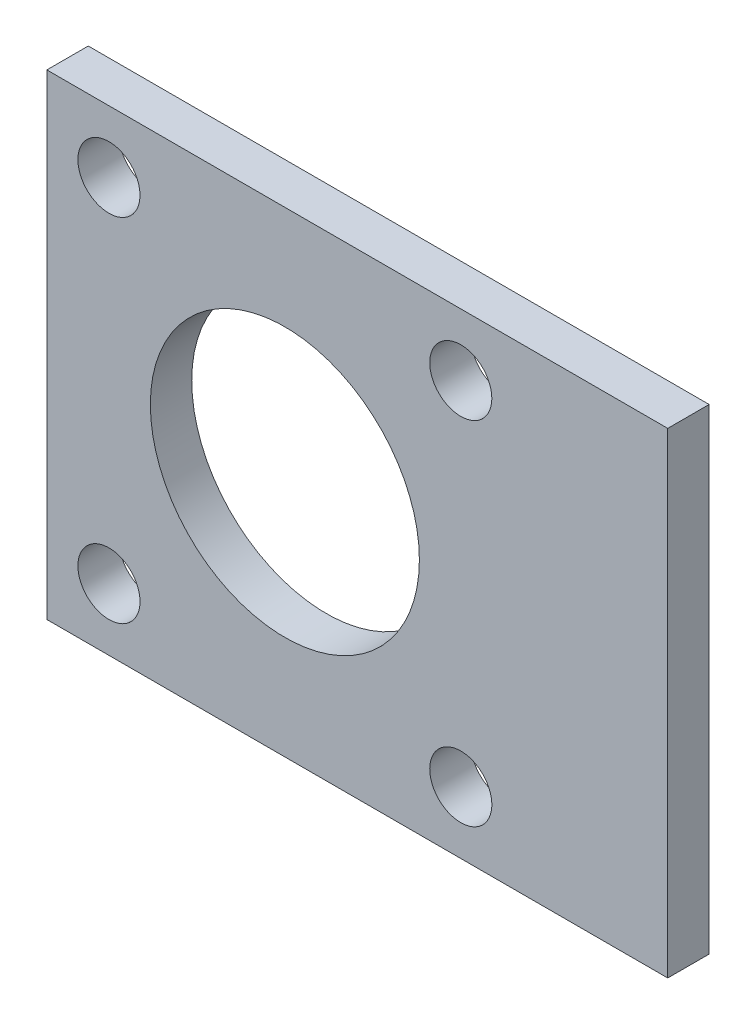
from build123d import *

# Parameters (mm, degrees)
ESBO_O1_W                = 30
ESBO_O1_H                = 23
RESSALTO_EXTRUS_O1_DEPTH = 2
ESBO_O2_R                = 6.5
ESBO_O2_R_2              = 1.5
CORTE_EXTRUS_O1_DEPTH    = 20.006577809


with BuildPart() as part:
    # Esboço1 → Ressalto-extrusão1 (new body)
    with BuildSketch(Plane.XY):
        Rectangle(ESBO_O1_W, ESBO_O1_H)
    extrude(amount=RESSALTO_EXTRUS_O1_DEPTH)

    # Esboço2 → Corte-extrusão1 (cut, through all)
    with BuildSketch(Plane.XY.offset(2)):
        with Locations((-3.5, 0)):
            Circle(ESBO_O2_R)
        with Locations((5, 8.5)):
            Circle(ESBO_O2_R_2)
        with Locations(Location((5, -8.5, 0), (0, 0, 180))):
            Circle(ESBO_O2_R_2)
        with Locations((-12, -8.5)):
            Circle(ESBO_O2_R_2)
        with Locations(Location((-12, 8.5, 0), (0, 0, 180))):
            Circle(ESBO_O2_R_2)
    extrude(amount=-CORTE_EXTRUS_O1_DEPTH, mode=Mode.SUBTRACT)


solid = part.part
